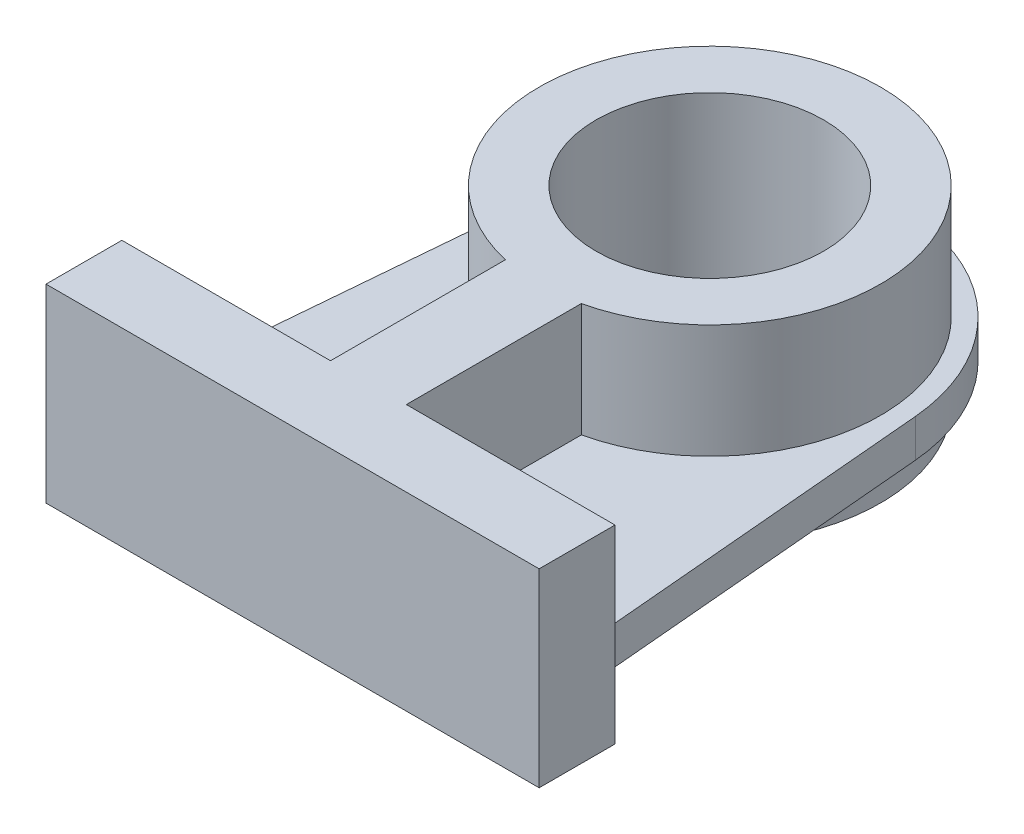
from build123d import *

# Parameters (mm, degrees)
SKETCH1_R           = 15
BOSS_EXTRUDE1_DEPTH = 25
BOSS_EXTRUDE2_START = 5
BOSS_EXTRUDE2_DEPTH = 5


with BuildPart() as part:
    # Sketch1 → Boss-Extrude1 (new body)
    with BuildSketch(Plane(origin=(0, 0, 0), x_dir=(1, 0, 0), z_dir=(0, 1, 0))):
        with BuildLine():
            Line((-32.5, -45), (-32.5, -55))
            Line((-32.5, -55), (32.5, -55))
            Line((32.5, -55), (32.5, -45))
            Line((32.5, -45), (5, -45))
            Line((5, -45), (5, -21.937410968))
            ThreePointArc((5, -21.937410968), (0, 22.5), (-5, -21.937410968))
            Line((-5, -21.937410968), (-5, -45))
            Line((-5, -45), (-32.5, -45))
        make_face()
        with Locations(Location((0, 0, 0), (0, 0, 270))):
            Circle(SKETCH1_R, mode=Mode.SUBTRACT)
    extrude(amount=BOSS_EXTRUDE1_DEPTH)

    # Sketch1<3> → Boss-Extrude2 (add)
    with BuildSketch(Plane(origin=(0, 0, 0), x_dir=(1, 0, 0), z_dir=(0, 1, 0)).offset(BOSS_EXTRUDE2_START)):
        with BuildLine():
            ThreePointArc((24.904867452, 2.178893569), (0, 25), (-24.904867452, 2.178893569))
            Line((-24.904867452, 2.178893569), (-29.032485797, -45))
            Line((-29.032485797, -45), (-5, -45))
            Line((-5, -45), (-5, -24.494897428))
            Line((-5, -24.494897428), (-5, -21.937410968))
            ThreePointArc((-5, -21.937410968), (-14.0312152, 17.589059099), (22.5, 0))
            ThreePointArc((22.5, 0), (17.589059099, -14.0312152), (5, -21.937410968))
            Line((5, -21.937410968), (5, -24.494897428))
            Line((5, -24.494897428), (5, -45))
            Line((5, -45), (29.032485797, -45))
            Line((29.032485797, -45), (24.904867452, 2.178893569))
        make_face()
    extrude(amount=BOSS_EXTRUDE2_DEPTH)


solid = part.part
